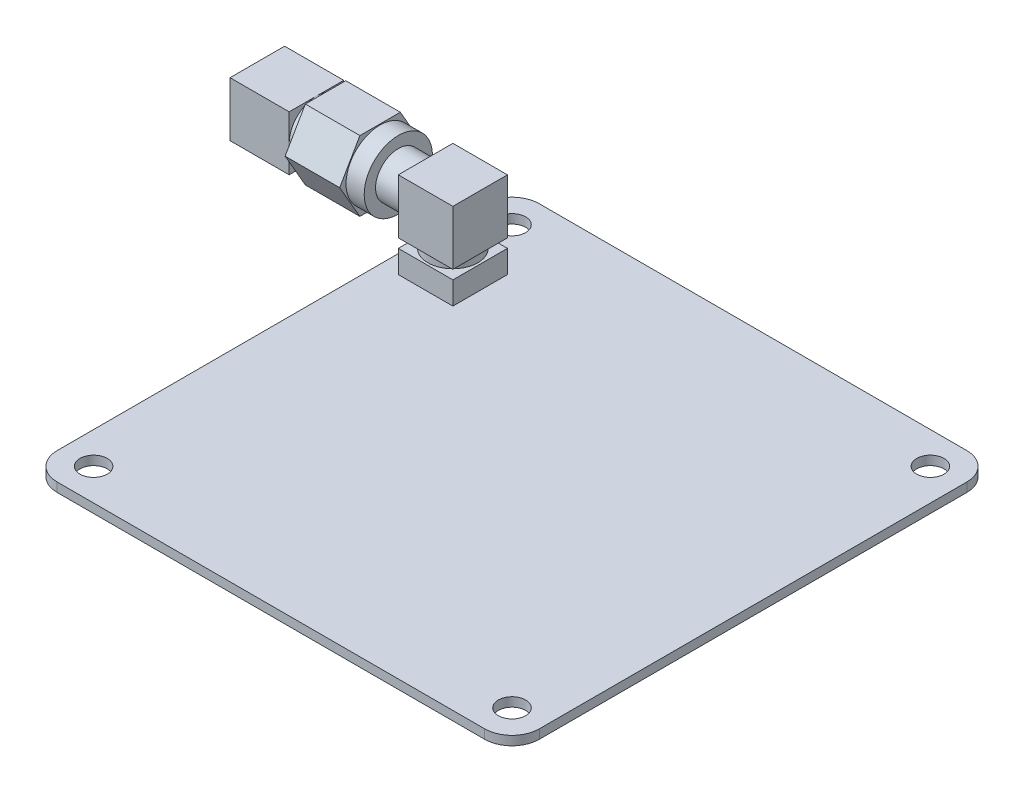
from build123d import *

# Parameters (mm, degrees)
SKETCH_1_W          = 53
SKETCH_1_H          = 53
EXTRUDE_1_DEPTH     = 1
SKETCH_2_W          = 6
SKETCH_2_H          = 6
EXTRUDE_2_DEPTH     = 2.5
SKETCH_3_R          = 2.75
EXTRUDE_3_DEPTH     = 1
SKETCH_4_W          = 6
SKETCH_4_H          = 6
EXTRUDE_4_DEPTH     = 6
SKETCH_5_R          = 2.5
EXTRUDE_5_DEPTH     = 3
SKETCH_6_R          = 3.75
EXTRUDE_6_DEPTH     = 2
EXTRUDE_7_DEPTH     = 6
SKETCH_8_R          = 3
EXTRUDE_8_DEPTH     = 1
SKETCH_9_W          = 6
SKETCH_9_H          = 6
EXTRUDE_9_DEPTH     = 6.5
SKETCH_11_R         = 1.5
CUT_EXTRUDE_1_DEPTH = 52.559407483
FILLET_1_R          = 3


with BuildPart() as part:
    # 草图1 → 凸台-拉伸1 (new body)
    with BuildSketch(Plane(origin=(0, 0, 0), x_dir=(1, 0, 0), z_dir=(0, 1, 0))):
        Rectangle(SKETCH_1_W, SKETCH_1_H)
    extrude(amount=EXTRUDE_1_DEPTH)

    # 草图2 → 凸台-拉伸2 (add)
    with BuildSketch(Plane(origin=(0, 1, 0), x_dir=(1, 0, 0), z_dir=(0, 1, 0))):
        with Locations((-21.5, 15)):
            Rectangle(SKETCH_2_W, SKETCH_2_H)
    extrude(amount=EXTRUDE_2_DEPTH)

    # 草图3 → 凸台-拉伸3 (add)
    with BuildSketch(Plane(origin=(0, 3.5, 0), x_dir=(1, 0, 0), z_dir=(0, 1, 0))):
        with Locations(Location((-21.5, 15, 0), (0, 0, 270))):
            Circle(SKETCH_3_R)
    extrude(amount=EXTRUDE_3_DEPTH)

    # 草图4 → 凸台-拉伸4 (add)
    with BuildSketch(Plane(origin=(0, 4.5, 0), x_dir=(1, 0, 0), z_dir=(0, 1, 0))):
        with Locations((-21.5, 15)):
            Rectangle(SKETCH_4_W, SKETCH_4_H)
    extrude(amount=EXTRUDE_4_DEPTH)

    # 草图5 → 凸台-拉伸5 (add)
    with BuildSketch(Plane.ZY.offset(24.5)):
        with Locations((-15, 7.5)):
            Circle(SKETCH_5_R)
    extrude(amount=EXTRUDE_5_DEPTH)

    # 草图6 → 凸台-拉伸6 (add)
    with BuildSketch(Plane.ZY.offset(27.5)):
        with Locations((-15, 7.5)):
            Circle(SKETCH_6_R)
    extrude(amount=EXTRUDE_6_DEPTH)

    # 草图7 → 凸台-拉伸7 (add)
    with BuildSketch(Plane.ZY.offset(29.5)):
        Polygon((-10.554402927, 7.5), (-12.777201464, 11.35), (-17.222798536, 11.35), (-19.445597073, 7.5), (-17.222798536, 3.65), (-12.777201464, 3.65), align=None)
    extrude(amount=EXTRUDE_7_DEPTH)

    # 草图8 → 凸台-拉伸8 (add)
    with BuildSketch(Plane.ZY.offset(35.5)):
        with Locations((-15, 7.5)):
            Circle(SKETCH_8_R)
    extrude(amount=EXTRUDE_8_DEPTH)

    # 草图9 → 凸台-拉伸9 (add)
    with BuildSketch(Plane.ZY.offset(36.5)):
        with Locations((-15, 7.5)):
            Rectangle(SKETCH_9_W, SKETCH_9_H)
    extrude(amount=EXTRUDE_9_DEPTH)

    # 草图11 → 切除-拉伸1 (cut, through all)
    with BuildSketch(Plane(origin=(0, 1, 0), x_dir=(1, 0, 0), z_dir=(0, 1, 0))):
        with Locations(Location((-23, -23, 0), (0, 0, 270))):
            Circle(SKETCH_11_R)
        with Locations(Location((-23, 23, 0), (0, 0, 270))):
            Circle(SKETCH_11_R)
        with Locations(Location((23, 23, 0), (0, 0, 270))):
            Circle(SKETCH_11_R)
        with Locations(Location((23, -23, 0), (0, 0, 270))):
            Circle(SKETCH_11_R)
    extrude(amount=-CUT_EXTRUDE_1_DEPTH, mode=Mode.SUBTRACT)

    # 圆角1
    fillet_1_edges = [part.edges().sort_by_distance(p)[0] for p in [
        (26.5, 0.5, 26.5),
        (-26.5, 0.5, 26.5),
        (-26.5, 0.5, -26.5),
        (26.5, 0.5, -26.5),
    ]]
    fillet(fillet_1_edges, radius=FILLET_1_R)


solid = part.part
